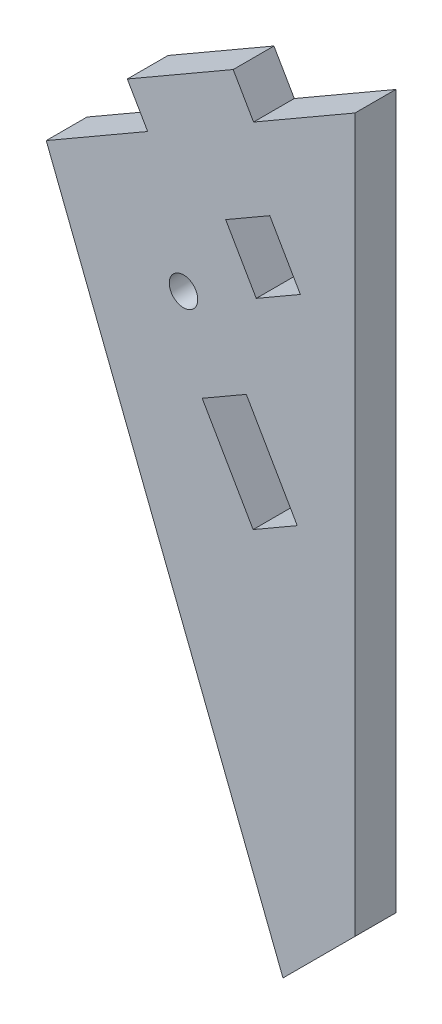
from build123d import *

# Parameters (mm, degrees)
EXTRUDE_1_DEPTH     = 4
EXTRUDE_2_DEPTH     = 5
CUT_EXTRUDE_1_DEPTH = 5
CUT_EXTRUDE_3_DEPTH = 5
EXTRUDE_3_DEPTH     = 4
SKETCH_8_W          = 12
SKETCH_8_H          = 4
CUT_EXTRUDE_4_DEPTH = 1
SKETCH_9_R          = 1.4
CUT_EXTRUDE_5_DEPTH = 4


with BuildPart() as part:
    # 草图1 → 凸台-拉伸1 (new body)
    with BuildSketch(Plane.XY):
        Polygon((-15.155444566, 17.5), (15.155444566, -35), (15.155444566, 35), align=None)
    extrude(amount=EXTRUDE_1_DEPTH)

    # 草图3 → 凸台-拉伸2 (add)
    with BuildSketch(Plane(origin=(-11.366583425, 19.6875, 0), x_dir=(0.8660254037844398, 0.499999999999998, 0), z_dir=(-0.49999999999999806, 0.8660254037844399, 0))):
        Polygon((7.125, -4), (13.125, -4), (19.125, -4), (19.125, 0), (7.125, 0), align=None)
    extrude(amount=EXTRUDE_2_DEPTH)

    # 草图4 → 切除-拉伸1 (cut)
    with BuildSketch(Plane(origin=(117.013646285, -126.133628904, 5), x_dir=(0.9999710727819138, 0.007606155361845417, 0), z_dir=(0, 0, 1))):
        Polygon((-106.588705014, 124.032873802), (-111.52268914, 132.7309081), (-115.871706289, 130.263916037), (-110.937722163, 121.565881739), align=None)
    extrude(amount=-CUT_EXTRUDE_1_DEPTH, mode=Mode.SUBTRACT)

    # 草图6 → 切除-拉伸3 (cut)
    with BuildSketch(Plane(origin=(116.750820958, -91.580334705, 5), x_dir=(0.9999710727819138, 0.007606155361845417, 0), z_dir=(0, 0, 1))):
        Polygon((-113.442317429, 112.033605516), (-110.481926953, 106.814784937), (-106.132909805, 109.281777), (-109.09330028, 114.500597579), align=None)
    extrude(amount=-CUT_EXTRUDE_3_DEPTH, mode=Mode.SUBTRACT)

    # 草图7 → 凸台-拉伸3 (add)
    with BuildSketch(Plane(origin=(0, 0, 0), x_dir=(-1, 0, 0), z_dir=(0, 0, -1))):
        Polygon((15.155444566, 17.5), (-15.155444566, -35), (-8.084376754, -42.071067812), align=None)
    extrude(amount=-EXTRUDE_3_DEPTH)

    # 草图8 → 切除-拉伸4 (cut)
    with BuildSketch(Plane(origin=(-13.866583425, 24.017627019, 0), x_dir=(0.8660254037844398, 0.49999999999999806, 0), z_dir=(-0.499999999999998, 0.8660254037844397, 0))):
        with Locations((13.125, -2)):
            Rectangle(SKETCH_8_W, SKETCH_8_H)
    extrude(amount=-CUT_EXTRUDE_4_DEPTH, mode=Mode.SUBTRACT)

    # 草图9 → 切除-拉伸5 (cut)
    with BuildSketch(Plane(origin=(116.744731615, -90.779776973, 0), x_dir=(-0.9999710727819138, -0.007606155361845545, 0), z_dir=(0, 0, -1))):
        with Locations(Location((117.644385016, 103.100964858, 0), (0, 0, 0.435804803))):
            Circle(SKETCH_9_R)
    extrude(amount=-CUT_EXTRUDE_5_DEPTH, mode=Mode.SUBTRACT)


solid = part.part
